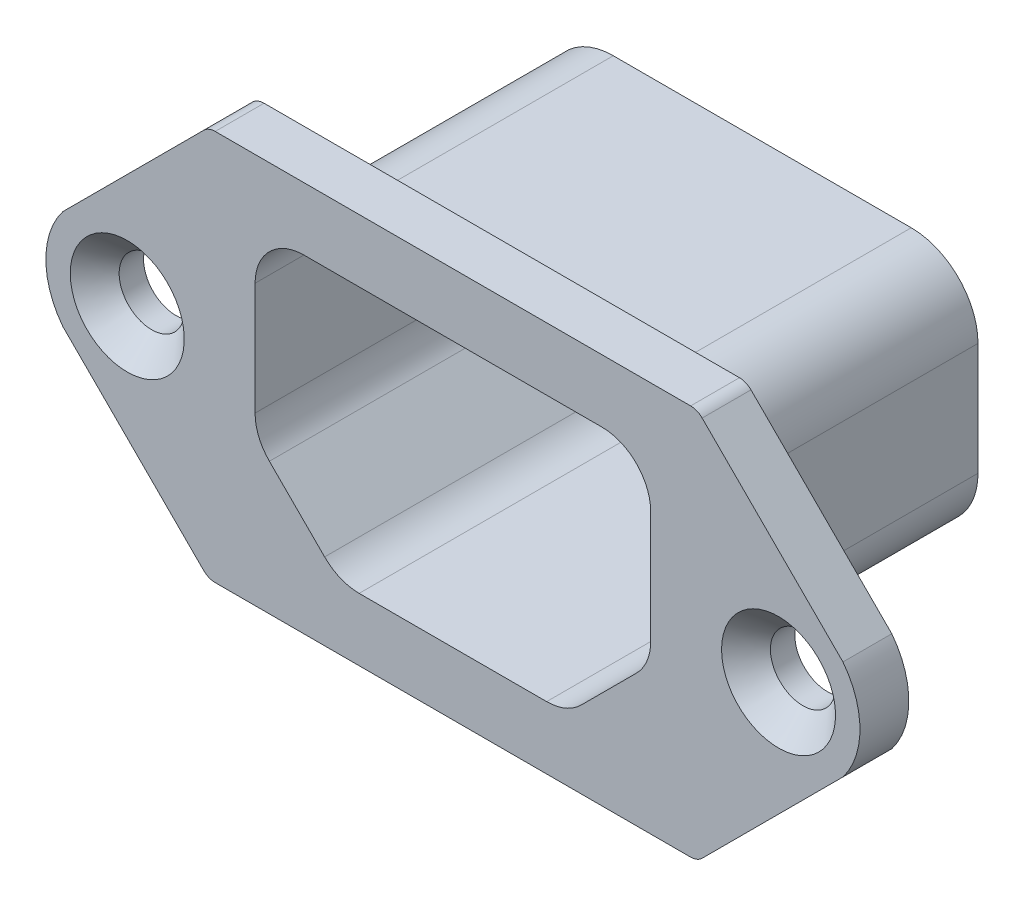
from build123d import *

# Parameters (mm, degrees)
SKETCH2_R           = 2
BOSS_EXTRUDE1_DEPTH = 1.5
BOSS_EXTRUDE2_DEPTH = 16
BOSS_EXTRUDE3_START = -1
BOSS_EXTRUDE3_DEPTH = 1
CHAMFER1_SIZE       = 1.5


with BuildPart() as part:
    # Sketch2 → Boss-Extrude1 (new, symmetric)
    with BuildSketch(Plane.XY):
        with BuildLine():
            Line((-15.307106781, 11.707106781), (-23.954546191, 3.059667371))
            ThreePointArc((-23.954546191, 3.059667371), (-25, 0), (-23.954546191, -3.059667371))
            Line((-23.954546191, -3.059667371), (-15.307106781, -11.707106781))
            ThreePointArc((-15.307106781, -11.707106781), (-14.982683432, -11.923879533), (-14.6, -12))
            Line((-14.6, -12), (14.6, -12))
            ThreePointArc((14.6, -12), (14.982683432, -11.923879533), (15.307106781, -11.707106781))
            Line((15.307106781, -11.707106781), (23.954546191, -3.059667371))
            ThreePointArc((23.954546191, -3.059667371), (25, 0), (23.954546191, 3.059667371))
            Line((23.954546191, 3.059667371), (15.307106781, 11.707106781))
            ThreePointArc((15.307106781, 11.707106781), (14.982683432, 11.923879533), (14.6, 12))
            Line((14.6, 12), (-14.6, 12))
            ThreePointArc((-14.6, 12), (-14.982683432, 11.923879533), (-15.307106781, 11.707106781))
        make_face()
        with Locations((-20, 0)):
            Circle(SKETCH2_R, mode=Mode.SUBTRACT)
        with Locations(Location((20, 0, 0), (0, 0, 180))):
            Circle(SKETCH2_R, mode=Mode.SUBTRACT)
        with BuildLine():
            Line((-11.271320344, -3.878679656), (-7.878679656, -7.271320344))
            ThreePointArc((-7.878679656, -7.271320344), (-6.90540961, -7.921638598), (-5.757359313, -8.15))
            Line((-5.757359313, -8.15), (5.757359313, -8.15))
            ThreePointArc((5.757359313, -8.15), (6.90540961, -7.921638598), (7.878679656, -7.271320344))
            Line((7.878679656, -7.271320344), (11.271320344, -3.878679656))
            ThreePointArc((11.271320344, -3.878679656), (11.921638598, -2.90540961), (12.15, -1.757359313))
            Line((12.15, -1.757359313), (12.15, 5.15))
            ThreePointArc((12.15, 5.15), (11.271320344, 7.271320344), (9.15, 8.15))
            Line((9.15, 8.15), (-9.15, 8.15))
            ThreePointArc((-9.15, 8.15), (-11.271320344, 7.271320344), (-12.15, 5.15))
            Line((-12.15, 5.15), (-12.15, -1.757359313))
            ThreePointArc((-12.15, -1.757359313), (-11.921638598, -2.90540961), (-11.271320344, -3.878679656))
        make_face(mode=Mode.SUBTRACT)
    extrude(amount=BOSS_EXTRUDE1_DEPTH, both=True)

    # Sketch3 → Boss-Extrude2 (add)
    with BuildSketch(Plane(origin=(0, 0, -1.5), x_dir=(-1, 0, 0), z_dir=(0, 0, -1))):
        with BuildLine():
            Line((-9.15, 9.25), (9.15, 9.25))
            ThreePointArc((9.15, 9.25), (12.049137803, 8.049137803), (13.25, 5.15))
            Line((13.25, 5.15), (13.25, -1.757359313))
            ThreePointArc((13.25, -1.757359313), (12.937906083, -3.326361386), (12.049137803, -4.656497116))
            Line((12.049137803, -4.656497116), (8.656497116, -8.049137803))
            ThreePointArc((8.656497116, -8.049137803), (7.326361386, -8.937906083), (5.757359313, -9.25))
            Line((5.757359313, -9.25), (-5.757359313, -9.25))
            ThreePointArc((-5.757359313, -9.25), (-7.326361386, -8.937906083), (-8.656497116, -8.049137803))
            Line((-8.656497116, -8.049137803), (-12.049137803, -4.656497116))
            ThreePointArc((-12.049137803, -4.656497116), (-12.937906083, -3.326361386), (-13.25, -1.757359313))
            Line((-13.25, -1.757359313), (-13.25, 5.15))
            ThreePointArc((-13.25, 5.15), (-12.049137803, 8.049137803), (-9.15, 9.25))
        make_face()
        with BuildLine():
            Line((12.15, 5.15), (12.15, -1.757359313))
            ThreePointArc((12.15, -1.757359313), (11.921638598, -2.90540961), (11.271320344, -3.878679656))
            Line((11.271320344, -3.878679656), (7.878679656, -7.271320344))
            ThreePointArc((7.878679656, -7.271320344), (6.90540961, -7.921638598), (5.757359313, -8.15))
            Line((5.757359313, -8.15), (-5.757359313, -8.15))
            ThreePointArc((-5.757359313, -8.15), (-6.90540961, -7.921638598), (-7.878679656, -7.271320344))
            Line((-7.878679656, -7.271320344), (-11.271320344, -3.878679656))
            ThreePointArc((-11.271320344, -3.878679656), (-11.921638598, -2.90540961), (-12.15, -1.757359313))
            Line((-12.15, -1.757359313), (-12.15, 5.15))
            ThreePointArc((-12.15, 5.15), (-11.271320344, 7.271320344), (-9.15, 8.15))
            Line((-9.15, 8.15), (9.15, 8.15))
            ThreePointArc((9.15, 8.15), (11.271320344, 7.271320344), (12.15, 5.15))
        make_face(mode=Mode.SUBTRACT)
    extrude(amount=BOSS_EXTRUDE2_DEPTH)

    # Sketch4 → Boss-Extrude3 (add)
    with BuildSketch(Plane(origin=(0, 0, -17.5), x_dir=(-1, 0, 0), z_dir=(0, 0, -1)).offset(BOSS_EXTRUDE3_START)):
        with BuildLine():
            Line((9.15, 9.25), (-9.15, 9.25))
            ThreePointArc((-9.15, 9.25), (-12.049137803, 8.049137803), (-13.25, 5.15))
            Line((-13.25, 5.15), (-13.25, -1.757359313))
            ThreePointArc((-13.25, -1.757359313), (-12.937906083, -3.326361386), (-12.049137803, -4.656497116))
            Line((-12.049137803, -4.656497116), (-8.656497116, -8.049137803))
            ThreePointArc((-8.656497116, -8.049137803), (-7.326361386, -8.937906083), (-5.757359313, -9.25))
            Line((-5.757359313, -9.25), (5.757359313, -9.25))
            ThreePointArc((5.757359313, -9.25), (7.326361386, -8.937906083), (8.656497116, -8.049137803))
            Line((8.656497116, -8.049137803), (12.049137803, -4.656497116))
            ThreePointArc((12.049137803, -4.656497116), (12.937906083, -3.326361386), (13.25, -1.757359313))
            Line((13.25, -1.757359313), (13.25, 5.15))
            ThreePointArc((13.25, 5.15), (12.049137803, 8.049137803), (9.15, 9.25))
        make_face()
    extrude(amount=BOSS_EXTRUDE3_DEPTH)

    # Chamfer1
    chamfer1_edges = [part.edges().sort_by_distance(p)[0] for p in [
        (22, 0, 1.5),
        (-22, 0, 1.5),
    ]]
    chamfer(chamfer1_edges, length=CHAMFER1_SIZE)


solid = part.part
